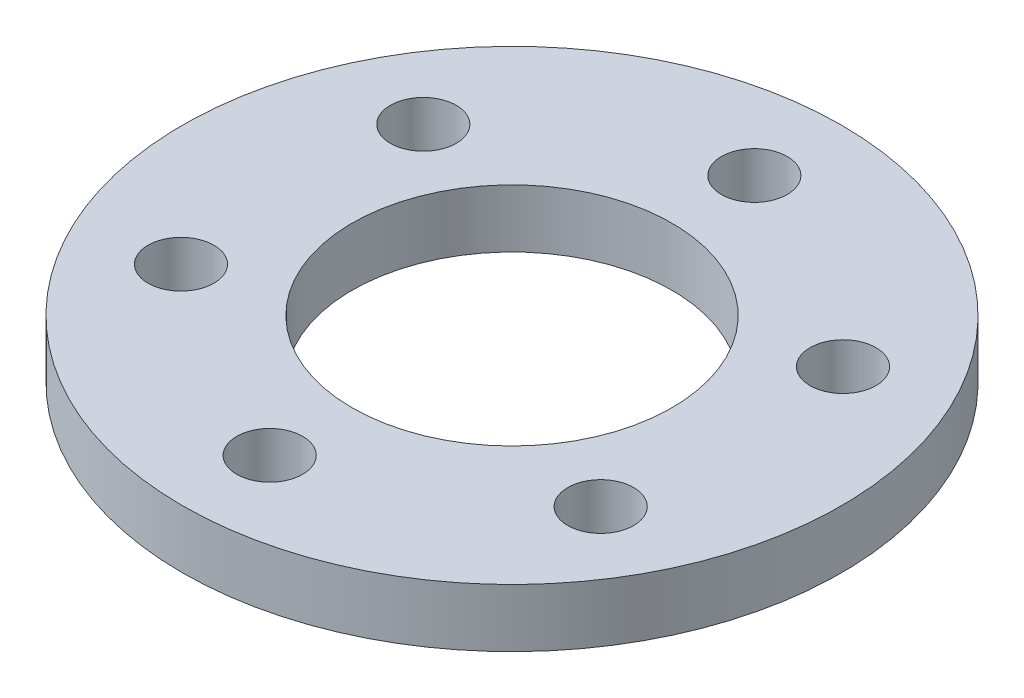
from build123d import *

# Parameters (mm, degrees)
SKETCH1_R           = 17
SKETCH1_R_2         = 8.25
SKETCH1_R_3         = 1.7
BOSS_EXTRUDE1_DEPTH = 3


with BuildPart() as part:
    # Sketch1 → Boss-Extrude1 (new body)
    with BuildSketch(Plane(origin=(0, 0, 0), x_dir=(1, 0, 0), z_dir=(0, 1, 0))):
        with Locations(Location((0, 0, 0), (0, 0, 270))):
            Circle(SKETCH1_R)
        with Locations(Location((0, 0, 0), (0, 0, 270))):
            Circle(SKETCH1_R_2, mode=Mode.SUBTRACT)
        with Locations(Location((0, 12.5, 0), (0, 0, 270))):
            Circle(SKETCH1_R_3, mode=Mode.SUBTRACT)
        with Locations(Location((10.825317547, 6.25, 0), (0, 0, 270))):
            Circle(SKETCH1_R_3, mode=Mode.SUBTRACT)
        with Locations(Location((10.825317547, -6.25, 0), (0, 0, 270))):
            Circle(SKETCH1_R_3, mode=Mode.SUBTRACT)
        with Locations(Location((0, -12.5, 0), (0, 0, 270))):
            Circle(SKETCH1_R_3, mode=Mode.SUBTRACT)
        with Locations(Location((-10.825317547, -6.25, 0), (0, 0, 270))):
            Circle(SKETCH1_R_3, mode=Mode.SUBTRACT)
        with Locations(Location((-10.825317547, 6.25, 0), (0, 0, 270))):
            Circle(SKETCH1_R_3, mode=Mode.SUBTRACT)
    extrude(amount=BOSS_EXTRUDE1_DEPTH)


solid = part.part
